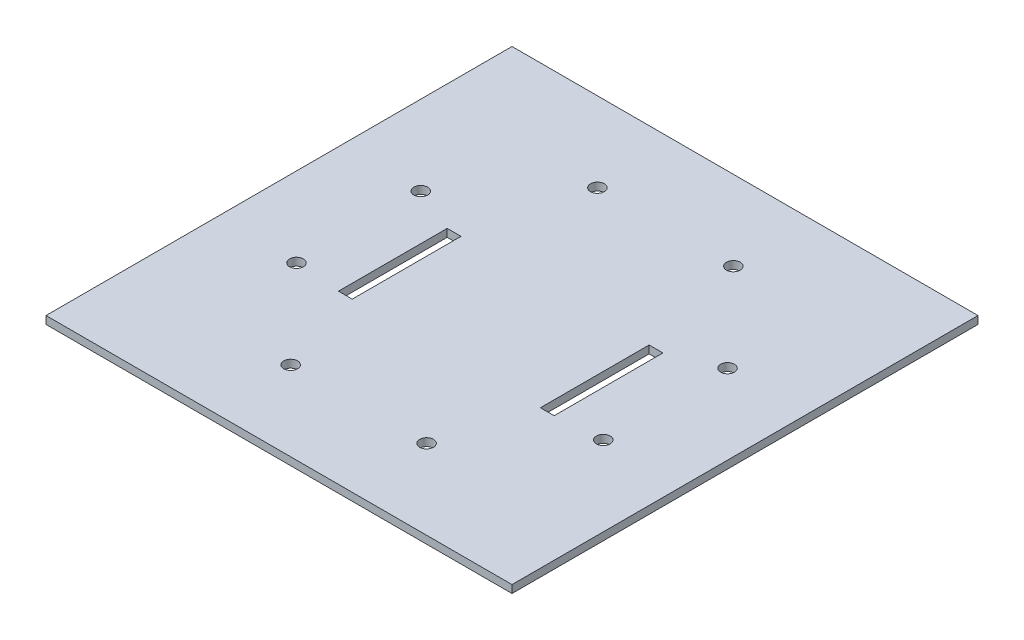
from build123d import *

# Parameters (mm, degrees)
SKETCH1_W           = 120
SKETCH1_H           = 120
BOSS_EXTRUDE1_DEPTH = 2
SKETCH2_R           = 1.775
CUT_EXTRUDE1_DEPTH  = 182.037166061
SKETCH3_R           = 1.775
CUT_EXTRUDE2_DEPTH  = 182.037166061
SKETCH4_W           = 3.55
SKETCH4_H           = 28
CUT_EXTRUDE3_DEPTH  = 182.037166061


with BuildPart() as part:
    # Sketch1 → Boss-Extrude1 (new body)
    with BuildSketch(Plane(origin=(0, 0, 0), x_dir=(1, 0, 0), z_dir=(0, 1, 0))):
        with Locations((104.879995502, 14.733142437)):
            Rectangle(SKETCH1_W, SKETCH1_H)
    extrude(amount=BOSS_EXTRUDE1_DEPTH)

    # Sketch2 → Cut-Extrude1 (cut, through all)
    with BuildSketch(Plane(origin=(0, 2, 0), x_dir=(1, 0, 0), z_dir=(0, 1, 0))):
        with Locations(Location((65.379995502, 30.733142437, 0), (0, 0, 270))):
            Circle(SKETCH2_R)
        with Locations(Location((65.379995502, -1.266857563, 0), (0, 0, 270))):
            Circle(SKETCH2_R)
        with Locations(Location((144.379995502, -1.266857563, 0), (0, 0, 270))):
            Circle(SKETCH2_R)
        with Locations(Location((144.379995502, 30.733142437, 0), (0, 0, 270))):
            Circle(SKETCH2_R)
    extrude(amount=-CUT_EXTRUDE1_DEPTH, mode=Mode.SUBTRACT)

    # Sketch3 → Cut-Extrude2 (cut, through all)
    with BuildSketch(Plane(origin=(0, 2, 0), x_dir=(1, 0, 0), z_dir=(0, 1, 0))):
        with Locations(Location((87.379995502, -24.766857563, 0), (0, 0, 270))):
            Circle(SKETCH3_R)
        with Locations(Location((87.379995502, 54.233142437, 0), (0, 0, 270))):
            Circle(SKETCH3_R)
        with Locations(Location((122.379995502, -24.766857563, 0), (0, 0, 270))):
            Circle(SKETCH3_R)
        with Locations(Location((122.379995502, 54.233142437, 0), (0, 0, 270))):
            Circle(SKETCH3_R)
    extrude(amount=-CUT_EXTRUDE2_DEPTH, mode=Mode.SUBTRACT)

    # Sketch4 → Cut-Extrude3 (cut, through all)
    with BuildSketch(Plane(origin=(0, 2, 0), x_dir=(1, 0, 0), z_dir=(0, 1, 0))):
        with Locations((78.879995502, 11.820412138)):
            Rectangle(SKETCH4_W, SKETCH4_H)
        with Locations((130.879995502, 11.820412138)):
            Rectangle(SKETCH4_W, SKETCH4_H)
    extrude(amount=-CUT_EXTRUDE3_DEPTH, mode=Mode.SUBTRACT)


solid = part.part
